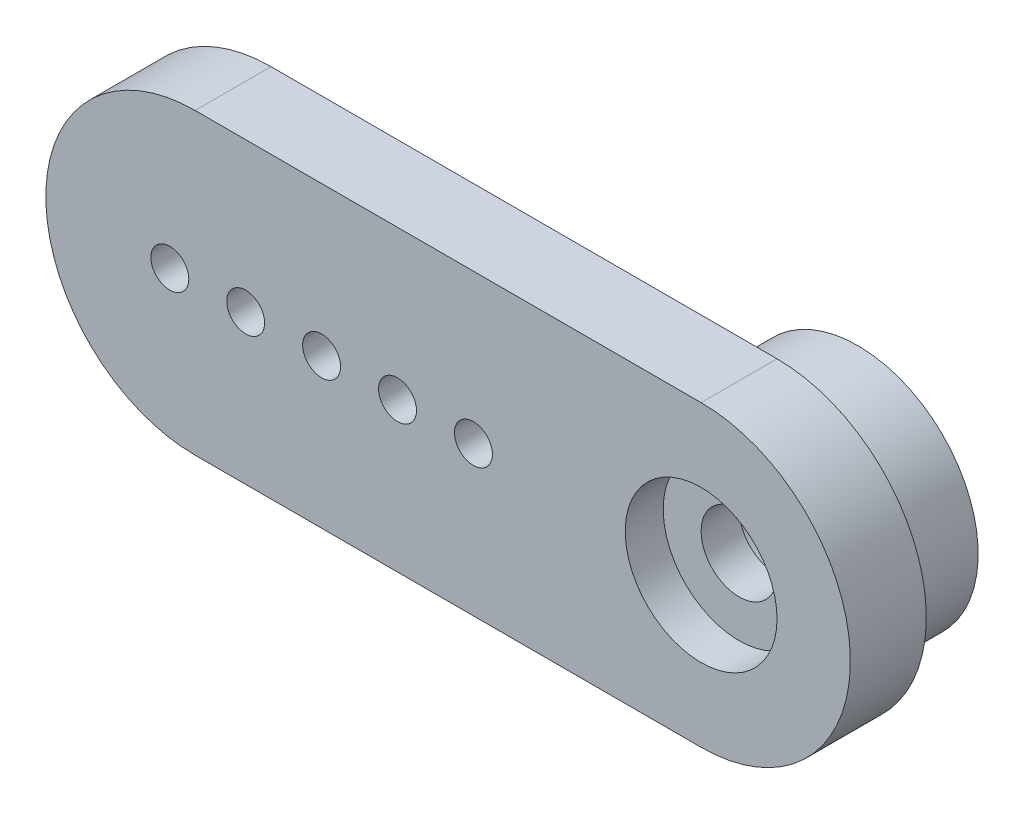
from build123d import *

# Parameters (mm, degrees)
ESQUISSE1_R        = 3
ESQUISSE1_R_2      = 0.75
BOSS_EXTRU_1_DEPTH = 3


with BuildPart() as part:
    # Esquisse1 → Boss.-Extru.1 (new body)
    with BuildSketch(Plane.XY):
        with BuildLine():
            Line((0, -5.9), (-20, -5.9))
            ThreePointArc((-20, -5.9), (-25.9, 0), (-20, 5.9))
            Line((-20, 5.9), (0, 5.9))
            ThreePointArc((0, 5.9), (5.9, 0), (0, -5.9))
        make_face()
        Circle(ESQUISSE1_R, mode=Mode.SUBTRACT)
        with Locations((-21, 0)):
            Circle(ESQUISSE1_R_2, mode=Mode.SUBTRACT)
        with Locations((-18, 0)):
            Circle(ESQUISSE1_R_2, mode=Mode.SUBTRACT)
        with Locations((-15, 0)):
            Circle(ESQUISSE1_R_2, mode=Mode.SUBTRACT)
        with Locations((-12, 0)):
            Circle(ESQUISSE1_R_2, mode=Mode.SUBTRACT)
        with Locations((-9, 0)):
            Circle(ESQUISSE1_R_2, mode=Mode.SUBTRACT)
    extrude(amount=-BOSS_EXTRU_1_DEPTH)

    # Esquisse2 → Révolution1 (revolve)
    with BuildSketch(Plane(origin=(0, 0, 0), x_dir=(1, 0, 0), z_dir=(0, 1, 0))):
        Polygon((-4.75, 6.2), (-2.75, 6.2), (-2.75, 3), (-1.5, 3), (-1.5, 1.5), (-4.75, 1.5), align=None)
    revolve(axis=Axis((0, 0, -6.2), (0, 0, 1)))


solid = part.part
